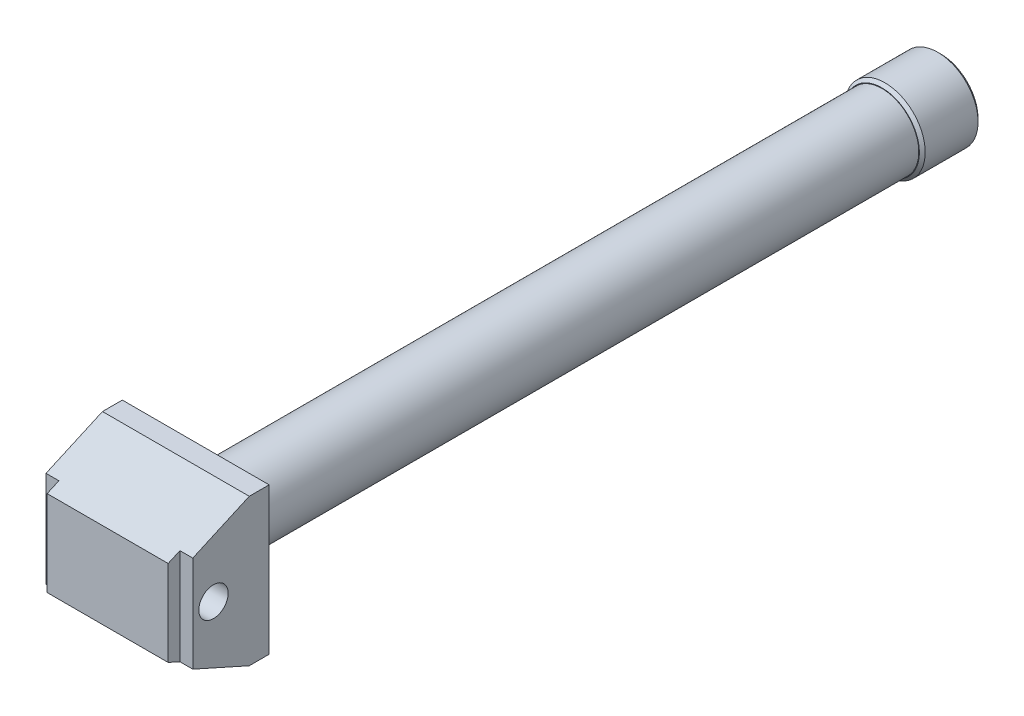
from build123d import *

# Parameters (mm, degrees)
SKETCH1_W           = 250
SKETCH1_H           = 250
BOSS_EXTRUDE1_DEPTH = 150
SKETCH2_R           = 62.5
BOSS_EXTRUDE2_DEPTH = 1269
SKETCH3_R           = 25
CUT_EXTRUDE1_DEPTH  = 1300.417561833
SKETCH4_R           = 37.5
CUT_EXTRUDE2_DEPTH  = 1269
SKETCH5_W           = 108.451595506
SKETCH5_H           = 320.715146067
CUT_EXTRUDE3_DEPTH  = 20
SKETCH6_R           = 68.445
SKETCH6_R_2         = 62.5
BOSS_EXTRUDE3_DEPTH = 100
CHAMFER1_SIZE       = 5
CHAMFER2_SIZE       = 5


with BuildPart() as part:
    # Sketch1 → Boss-Extrude1 (new body)
    with BuildSketch(Plane.XY):
        Rectangle(SKETCH1_W, SKETCH1_H)
    extrude(amount=BOSS_EXTRUDE1_DEPTH)

    # Sketch2 → Boss-Extrude2 (add)
    with BuildSketch(Plane(origin=(0, 0, 0), x_dir=(-1, 0, 0), z_dir=(0, 0, -1))):
        Circle(SKETCH2_R)
    extrude(amount=BOSS_EXTRUDE2_DEPTH)

    # Sketch3 → Cut-Extrude1 (cut, through all)
    with BuildSketch(Plane.ZY.offset(125)):
        with Locations(Location((94.75, 0, 0), (0, 0, 270))):
            Circle(SKETCH3_R)
        Polygon((150, -73), (150, -125), (33.82, -125), align=None)
        Polygon((150, 125), (33.82, 125), (150, 73), align=None)
    extrude(amount=-CUT_EXTRUDE1_DEPTH, mode=Mode.SUBTRACT)

    # Sketch4 → Cut-Extrude2 (cut)
    with BuildSketch(Plane(origin=(0, 0, -1269), x_dir=(-1, 0, 0), z_dir=(0, 0, -1))):
        Circle(SKETCH4_R)
    extrude(amount=-CUT_EXTRUDE2_DEPTH, mode=Mode.SUBTRACT)

    # Sketch5 → Cut-Extrude3 (cut)
    with BuildSketch(Plane.XY.offset(150)):
        with Locations((-157.285797753, 0.869932585)):
            Rectangle(SKETCH5_W, SKETCH5_H)
        with Locations((157.285797753, 0.869932585)):
            Rectangle(SKETCH5_W, SKETCH5_H)
    extrude(amount=-CUT_EXTRUDE3_DEPTH, mode=Mode.SUBTRACT)

    # Chamfer2
    chamfer2_edges = [part.edges().sort_by_distance(p)[0] for p in [
        (37.5, 0, -1269),
    ]]
    chamfer(chamfer2_edges, length=CHAMFER2_SIZE)


with BuildPart() as body_2:
    # Sketch6 → Boss-Extrude3 (new body)
    with BuildSketch(Plane(origin=(0, 0, -1269), x_dir=(-1, 0, 0), z_dir=(0, 0, -1))):
        Circle(SKETCH6_R)
        Circle(SKETCH6_R_2, mode=Mode.SUBTRACT)
    extrude(amount=-BOSS_EXTRUDE3_DEPTH)

    # Chamfer1
    chamfer1_edges = [body_2.edges().sort_by_distance(p)[0] for p in [
        (68.445, 0, -1269),
        (68.445, 0, -1169),
    ]]
    chamfer(chamfer1_edges, length=CHAMFER1_SIZE)


solid = Compound([part.part, body_2.part])
